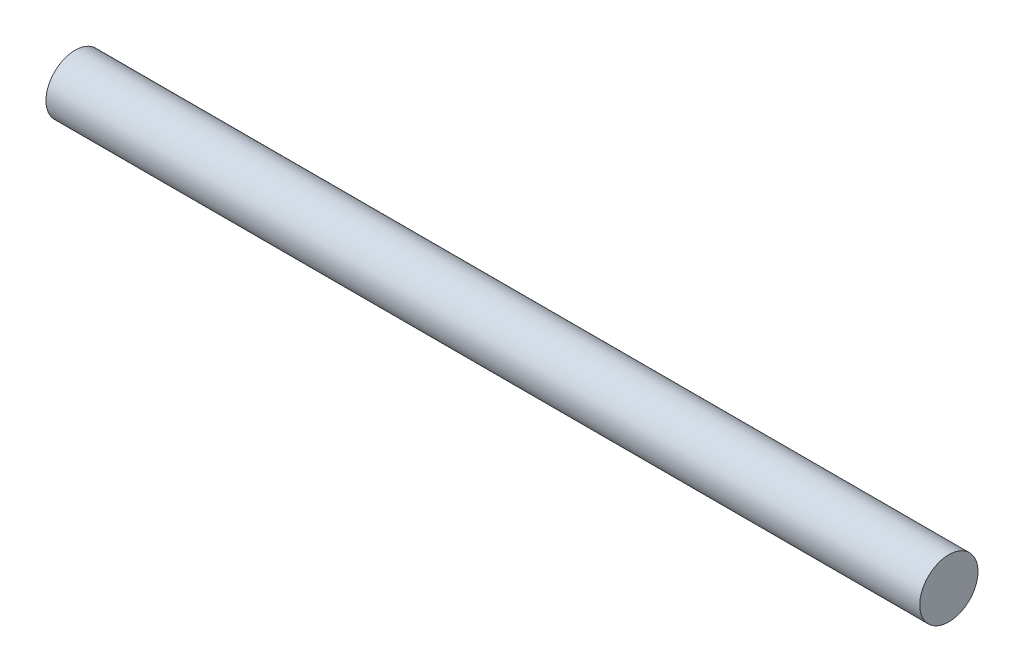
from build123d import *

# Parameters (mm, degrees)
SKETCH2_R           = 5
BOSS_EXTRUDE1_DEPTH = 75


with BuildPart() as part:
    # Sketch2 → Boss-Extrude1 (new, symmetric)
    with BuildSketch(Plane.YZ):
        with Locations(Location((0, 0, 0), (0, 0, 270))):
            Circle(SKETCH2_R)
    extrude(amount=BOSS_EXTRUDE1_DEPTH, both=True)


solid = part.part
